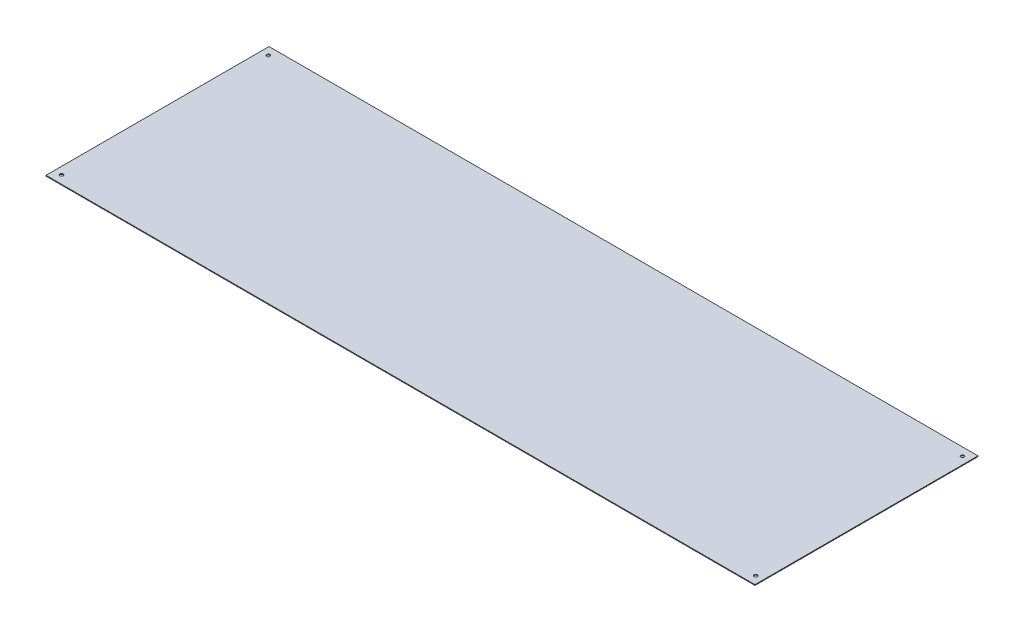
from build123d import *

# Parameters (mm, degrees)
SKETCH1_W   = 1920
SKETCH1_H   = 604
SKETCH1_R   = 4.5
THICKEN1_T1 = 2


with BuildPart() as body_1:
    # Sketch1 → Surface-Plane1: a flat surface bounded by the sketch
    with BuildSketch(Plane(origin=(0, 0, 0), x_dir=(1, 0, 0), z_dir=(0, 1, 0)), mode=Mode.PRIVATE) as surface_plane1_1_region:
        Rectangle(SKETCH1_W, SKETCH1_H)
        with Locations(Location((-940, 280, 0), (0, 0, 270))):
            Circle(SKETCH1_R, mode=Mode.SUBTRACT)
        with Locations(Location((940, 280, 0), (0, 0, 270))):
            Circle(SKETCH1_R, mode=Mode.SUBTRACT)
        with Locations(Location((940, -280, 0), (0, 0, 270))):
            Circle(SKETCH1_R, mode=Mode.SUBTRACT)
        with Locations(Location((-940, -280, 0), (0, 0, 270))):
            Circle(SKETCH1_R, mode=Mode.SUBTRACT)
    surface_plane1_1 = surface_plane1_1_region.sketch.faces()[0]
    add(Solid.thicken(surface_plane1_1, THICKEN1_T1))


solid = body_1.part
